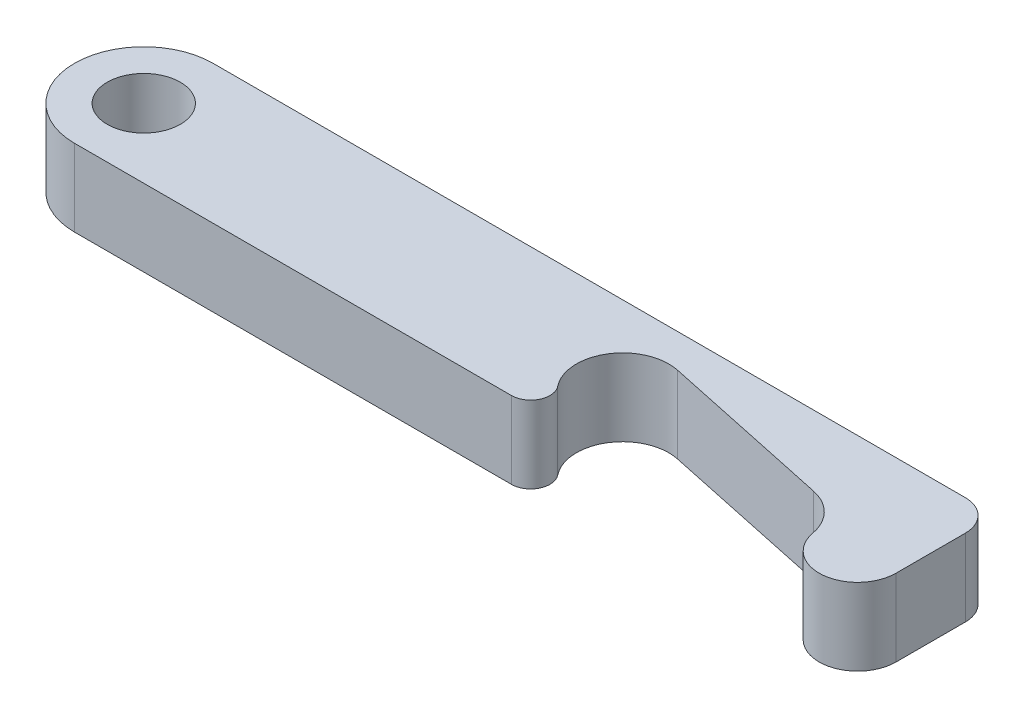
from build123d import *

# Parameters (mm, degrees)
SKETCH1_R           = 4.75
BOSS_EXTRUDE1_DEPTH = 10


with BuildPart() as part:
    # Sketch1 → Boss-Extrude1 (new body)
    with BuildSketch(Plane(origin=(0, 0, 0), x_dir=(1, 0, 0), z_dir=(0, 1, 0))):
        with BuildLine():
            Line((47.257849632, 9), (-50.5, 9))
            ThreePointArc((-50.5, 9), (-59.5, 0), (-50.5, -9))
            Line((-50.5, -9), (6.281995059, -9))
            ThreePointArc((6.281995059, -9), (8.533017918, -7.587610265), (8.240583514, -4.946316871))
            ThreePointArc((8.240583514, -4.946316871), (7.841183108, 1.943198276), (14.18866595, 4.651408242))
            Line((14.18866595, 4.651408242), (36.68866595, -0.131114396))
            ThreePointArc((36.68866595, -0.131114396), (39.739895868, -1.814169405), (41.341188802, -4.909090909))
            ThreePointArc((41.341188802, -4.909090909), (43.059838886, -7.843530574), (46.257849632, -9))
            ThreePointArc((46.257849632, -9), (49.793383538, -7.535533906), (51.257849632, -4))
            Line((51.257849632, -4), (51.257849632, 5))
            ThreePointArc((51.257849632, 5), (50.086276756, 7.828427125), (47.257849632, 9))
        make_face()
        with Locations(Location((-50.5, 0, 0), (0, 0, 270))):
            Circle(SKETCH1_R, mode=Mode.SUBTRACT)
    extrude(amount=BOSS_EXTRUDE1_DEPTH)


solid = part.part
